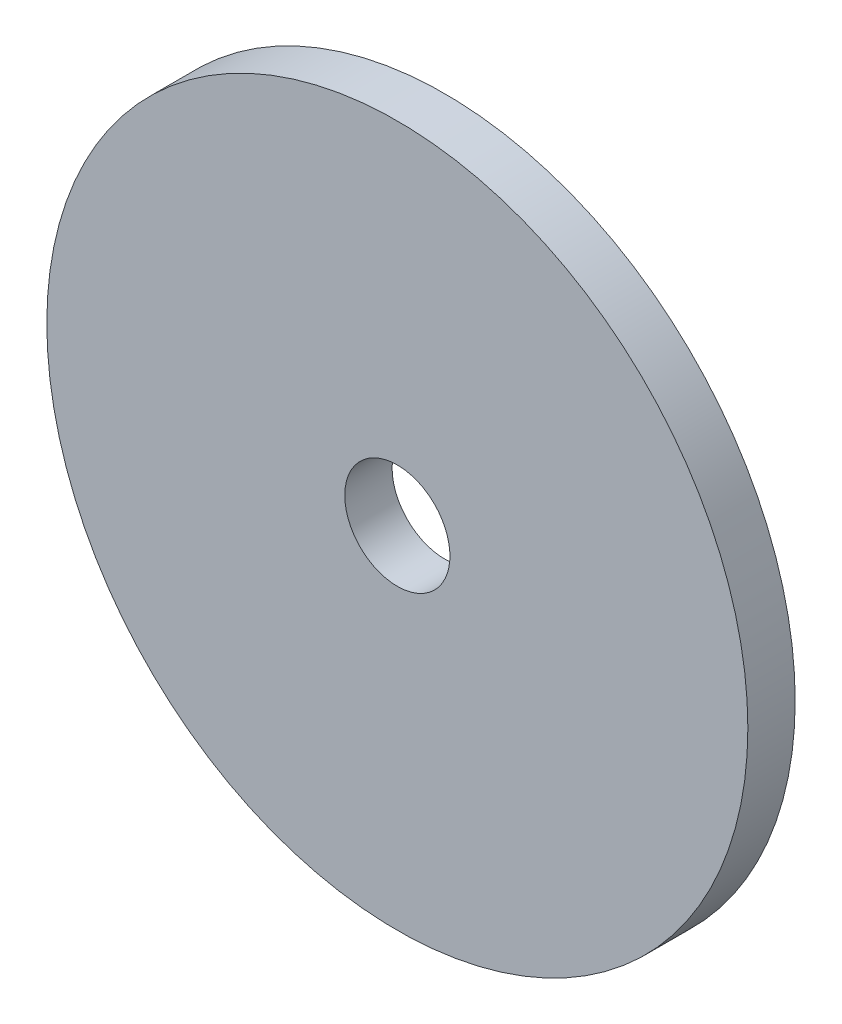
from build123d import *

# Parameters (mm, degrees)
SKETCH1_R           = 20
SKETCH1_R_2         = 3
BOSS_EXTRUDE1_DEPTH = 2.7


with BuildPart() as part:
    # Sketch1 → Boss-Extrude1 (new body)
    with BuildSketch(Plane.XY):
        with Locations(Location((-26.007469445, -4.968616707, 0), (0, 0, 180))):
            Circle(SKETCH1_R)
        with Locations(Location((-26.007469445, -4.968616707, 0), (0, 0, 180))):
            Circle(SKETCH1_R_2, mode=Mode.SUBTRACT)
    extrude(amount=BOSS_EXTRUDE1_DEPTH)


solid = part.part
